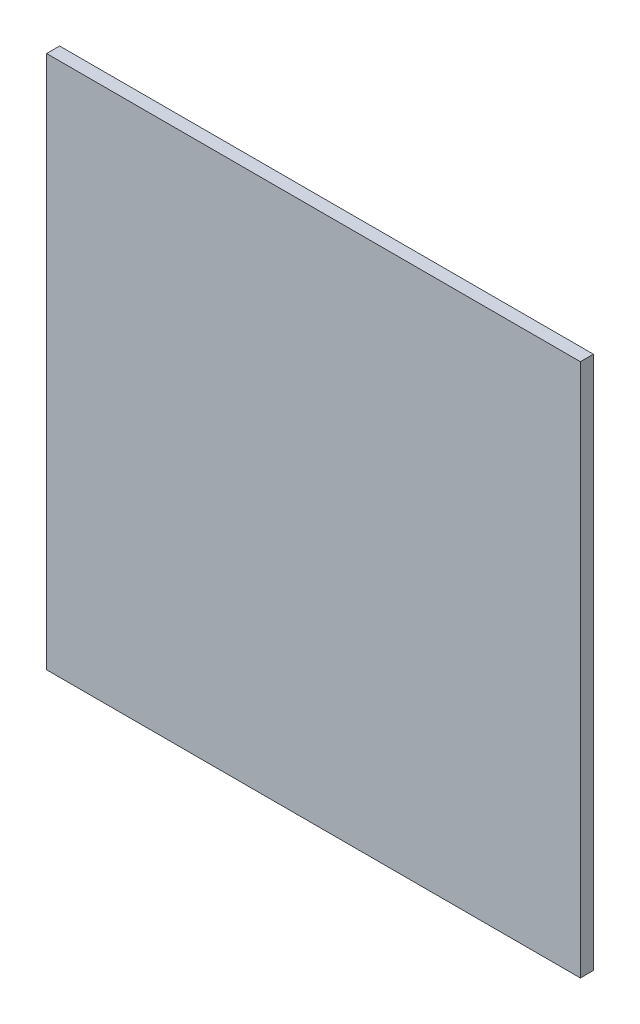
from build123d import *

# Parameters (mm, degrees)
SKETCH_1_W      = 410
SKETCH_1_H      = 410
EXTRUDE_1_DEPTH = 10


with BuildPart() as part:
    # 草圖1 → 填料-伸長1 (new body)
    with BuildSketch(Plane.XY):
        Rectangle(SKETCH_1_W, SKETCH_1_H)
    extrude(amount=EXTRUDE_1_DEPTH)


solid = part.part
